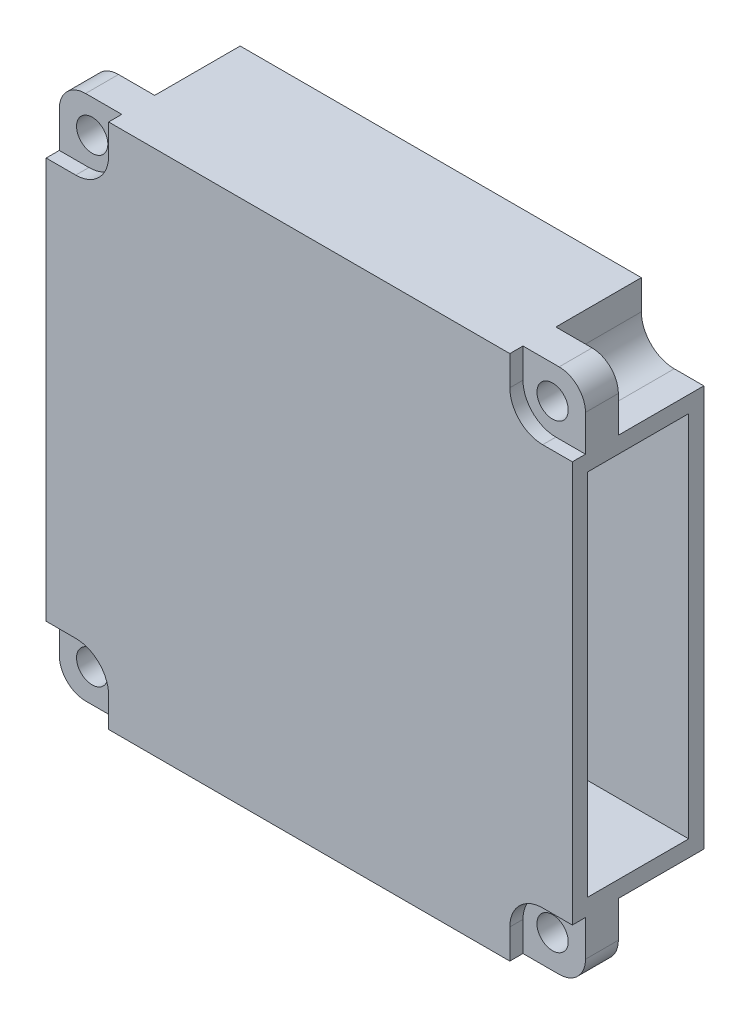
from build123d import *

# Parameters (mm, degrees)
SKETCH_1_W          = 40
SKETCH_1_H          = 40
EXTRUDE_1_DEPTH     = 5
SKETCH_2_W          = 7.7
SKETCH_2_H          = 28
CUT_EXTRUDE_1_DEPTH = 10
CUT_EXTRUDE_2_DEPTH = 6.5
FILLET_1_R          = 2
CUT_EXTRUDE_START   = -1
CUT_EXTRUDE_3_DEPTH = 1
CUT_EXTRUDE_4_REACH = 31.682
SKETCH_5_R          = 1.189
SKETCH_6_R          = 14
CUT_EXTRUDE_5_DEPTH = 1


with BuildPart() as part:
    # 草图1 → 凸台-拉伸1 (new, symmetric)
    with BuildSketch(Plane.XY):
        Rectangle(SKETCH_1_W, SKETCH_1_H)
    extrude(amount=EXTRUDE_1_DEPTH, both=True)

    # 草图2 → 切除-拉伸1 (cut)
    with BuildSketch(Plane(origin=(20, 0, 0), x_dir=(0, 0, -1), z_dir=(1, 0, 0))):
        Rectangle(SKETCH_2_W, SKETCH_2_H)
    extrude(amount=-CUT_EXTRUDE_1_DEPTH, mode=Mode.SUBTRACT)

    # 草图3 → 切除-拉伸2 (cut)
    with BuildSketch(Plane(origin=(0, 0, -5), x_dir=(-1, 0, 0), z_dir=(0, 0, -1))):
        with BuildLine():
            Line((20, 20), (15.25, 20))
            Line((15.25, 20), (15.25, 17.75))
            ThreePointArc((15.25, 17.75), (15.982233047, 15.982233047), (17.75, 15.25))
            Line((17.75, 15.25), (20, 15.25))
            Line((20, 15.25), (20, 20))
        make_face()
        with BuildLine():
            Line((20, -20), (20, -15.25))
            Line((20, -15.25), (17.75, -15.25))
            ThreePointArc((17.75, -15.25), (15.982233047, -15.982233047), (15.25, -17.75))
            Line((15.25, -17.75), (15.25, -20))
            Line((15.25, -20), (20, -20))
        make_face()
        with BuildLine():
            Line((-17.75, -15.25), (-20, -15.25))
            Line((-20, -15.25), (-20, -20))
            Line((-20, -20), (-15.25, -20))
            Line((-15.25, -20), (-15.25, -17.75))
            ThreePointArc((-15.25, -17.75), (-15.982233047, -15.982233047), (-17.75, -15.25))
        make_face()
        with BuildLine():
            Line((-15.25, 17.75), (-15.25, 20))
            Line((-15.25, 20), (-20, 20))
            Line((-20, 20), (-20, 15.25))
            Line((-20, 15.25), (-17.75, 15.25))
            ThreePointArc((-17.75, 15.25), (-15.982233047, 15.982233047), (-15.25, 17.75))
        make_face()
    extrude(amount=-CUT_EXTRUDE_2_DEPTH, mode=Mode.SUBTRACT)

    # 圆角1
    fillet_1_edges = [part.edges().sort_by_distance(p)[0] for p in [
        (20, -20, 3.25),
        (-20, -20, 3.25),
        (-20, 20, 3.25),
        (20, 20, 3.25),
    ]]
    fillet(fillet_1_edges, radius=FILLET_1_R)

    # 草图4 → 切除-拉伸3 (cut)
    with BuildSketch(Plane.XY.offset(5).offset(CUT_EXTRUDE_START)):
        with BuildLine():
            Line((20, -15.25), (20, -18))
            ThreePointArc((20, -18), (19.414213562, -19.414213562), (18, -20))
            Line((18, -20), (15.25, -20))
            Line((15.25, -20), (15.25, -17.75))
            ThreePointArc((15.25, -17.75), (15.982233047, -15.982233047), (17.75, -15.25))
            Line((17.75, -15.25), (20, -15.25))
        make_face()
        with BuildLine():
            Line((-15.25, -20), (-18, -20))
            ThreePointArc((-18, -20), (-19.414213562, -19.414213562), (-20, -18))
            Line((-20, -18), (-20, -15.25))
            Line((-20, -15.25), (-17.75, -15.25))
            ThreePointArc((-17.75, -15.25), (-15.982233047, -15.982233047), (-15.25, -17.75))
            Line((-15.25, -17.75), (-15.25, -20))
        make_face()
        with BuildLine():
            Line((15.25, 20), (18, 20))
            ThreePointArc((18, 20), (19.414213562, 19.414213562), (20, 18))
            Line((20, 18), (20, 15.25))
            Line((20, 15.25), (17.75, 15.25))
            ThreePointArc((17.75, 15.25), (15.982233047, 15.982233047), (15.25, 17.75))
            Line((15.25, 17.75), (15.25, 20))
        make_face()
        with BuildLine():
            Line((-20, 15.25), (-20, 18))
            ThreePointArc((-20, 18), (-19.414213562, 19.414213562), (-18, 20))
            Line((-18, 20), (-15.25, 20))
            Line((-15.25, 20), (-15.25, 17.75))
            ThreePointArc((-15.25, 17.75), (-15.982233047, 15.982233047), (-17.75, 15.25))
            Line((-17.75, 15.25), (-20, 15.25))
        make_face()
    extrude(amount=CUT_EXTRUDE_3_DEPTH, mode=Mode.SUBTRACT)

    # 草图5 → 切除-拉伸4 (cut, up to next)
    with BuildSketch(Plane.XY.offset(4), mode=Mode.PRIVATE) as cut_extrude_4_sk1:
        with Locations((-17.5, 17.5)):
            Circle(SKETCH_5_R)
    cut_extrude_4_tool1 = extrude(cut_extrude_4_sk1.sketch, amount=-CUT_EXTRUDE_4_REACH, mode=Mode.PRIVATE) & part.part
    # 草图5 → 切除-拉伸4 (cut, up to next)
    with BuildSketch(Plane.XY.offset(4), mode=Mode.PRIVATE) as cut_extrude_4_sk2:
        with Locations(Location((-17.5, -17.5, 0), (0, 0, 180))):
            Circle(SKETCH_5_R)
    cut_extrude_4_tool2 = extrude(cut_extrude_4_sk2.sketch, amount=-CUT_EXTRUDE_4_REACH, mode=Mode.PRIVATE) & part.part
    # 草图5 → 切除-拉伸4 (cut, up to next)
    with BuildSketch(Plane.XY.offset(4), mode=Mode.PRIVATE) as cut_extrude_4_sk3:
        with Locations((17.5, -17.5)):
            Circle(SKETCH_5_R)
    cut_extrude_4_tool3 = extrude(cut_extrude_4_sk3.sketch, amount=-CUT_EXTRUDE_4_REACH, mode=Mode.PRIVATE) & part.part
    # 草图5 → 切除-拉伸4 (cut, up to next)
    with BuildSketch(Plane.XY.offset(4), mode=Mode.PRIVATE) as cut_extrude_4_sk4:
        with Locations(Location((17.5, 17.5, 0), (0, 0, 180))):
            Circle(SKETCH_5_R)
    cut_extrude_4_tool4 = extrude(cut_extrude_4_sk4.sketch, amount=-CUT_EXTRUDE_4_REACH, mode=Mode.PRIVATE) & part.part
    add(cut_extrude_4_tool1.solids().sort_by_distance((-17.5, 17.5, 4))[0], mode=Mode.SUBTRACT)
    add(cut_extrude_4_tool2.solids().sort_by_distance((-17.5, -17.5, 4))[0], mode=Mode.SUBTRACT)
    add(cut_extrude_4_tool3.solids().sort_by_distance((17.5, -17.5, 4))[0], mode=Mode.SUBTRACT)
    add(cut_extrude_4_tool4.solids().sort_by_distance((17.5, 17.5, 4))[0], mode=Mode.SUBTRACT)

    # 草图6 → 切除-拉伸5 (cut)
    with BuildSketch(Plane(origin=(0, 0, -5), x_dir=(-1, 0, 0), z_dir=(0, 0, -1))):
        with Locations((-0.5, -4)):
            Circle(SKETCH_6_R)
    extrude(amount=-CUT_EXTRUDE_5_DEPTH, mode=Mode.SUBTRACT)


solid = part.part
